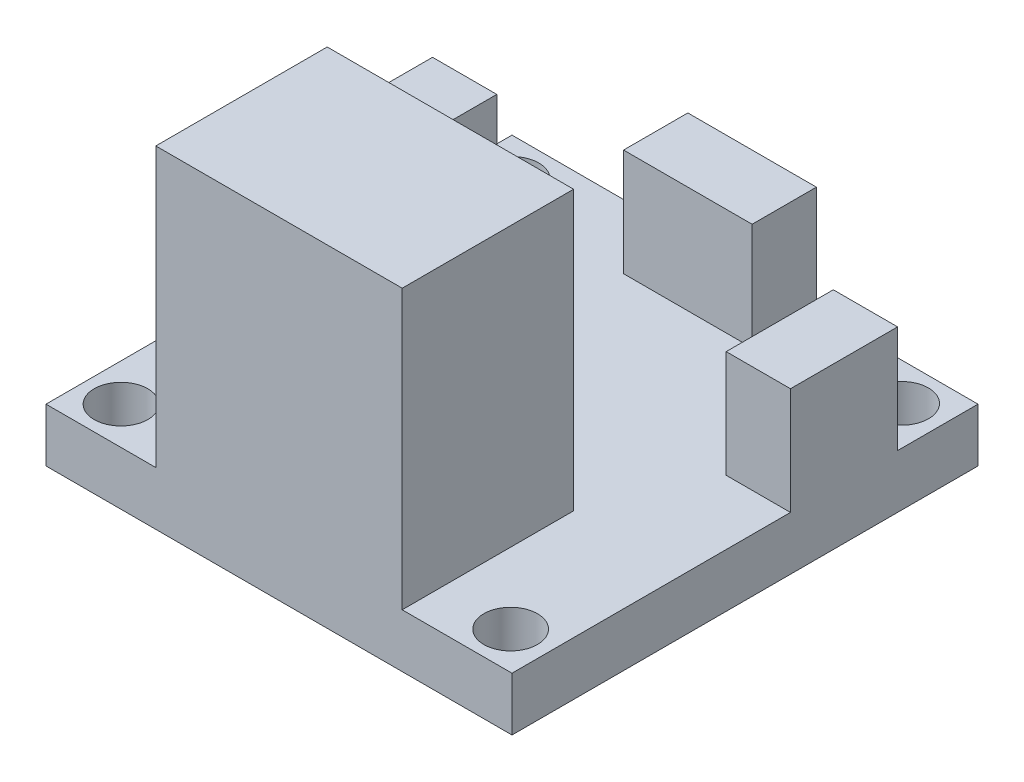
from build123d import *

# Parameters (mm, degrees)
SKETCH2_W           = 43.5
SKETCH2_H           = 43.5
BOSS_EXTRUDE1_DEPTH = 5
SKETCH4_W           = 23
SKETCH4_H           = 16
BOSS_EXTRUDE2_DEPTH = 26
SKETCH5_W           = 6
SKETCH5_H           = 10
SKETCH5_W_2         = 12
SKETCH5_H_2         = 6
BOSS_EXTRUDE3_DEPTH = 10
SKETCH6_R           = 2.5
CUT_EXTRUDE1_DEPTH  = 41.275612969


with BuildPart() as part:
    # Sketch2 → Boss-Extrude1 (new body)
    with BuildSketch(Plane(origin=(0, 0, 0), x_dir=(1, 0, 0), z_dir=(0, 1, 0))):
        Rectangle(SKETCH2_W, SKETCH2_H)
    extrude(amount=BOSS_EXTRUDE1_DEPTH)

    # Sketch4 → Boss-Extrude2 (add)
    with BuildSketch(Plane(origin=(0, 5, 0), x_dir=(1, 0, 0), z_dir=(0, 1, 0))):
        with Locations((0, -13.75)):
            Rectangle(SKETCH4_W, SKETCH4_H)
    extrude(amount=BOSS_EXTRUDE2_DEPTH)

    # Sketch5 → Boss-Extrude3 (add)
    with BuildSketch(Plane(origin=(0, 5, 0), x_dir=(1, 0, 0), z_dir=(0, 1, 0))):
        with Locations((-18.75, 9.331650707)):
            Rectangle(SKETCH5_W, SKETCH5_H)
        with Locations((0.664199044, 18.75)):
            Rectangle(SKETCH5_W_2, SKETCH5_H_2)
        with Locations((18.75, 9.243455857)):
            Rectangle(SKETCH5_W, SKETCH5_H)
    extrude(amount=BOSS_EXTRUDE3_DEPTH)

    # Sketch6 → Cut-Extrude1 (cut, through all)
    with BuildSketch(Plane(origin=(0, 5, 0), x_dir=(1, 0, 0), z_dir=(0, 1, 0))):
        with Locations(Location((-18.25, 18.25, 0), (0, 0, 270))):
            Circle(SKETCH6_R)
        with Locations(Location((18.124031363, 18.25, 0), (0, 0, 270))):
            Circle(SKETCH6_R)
        with Locations(Location((18.124031363, -18.25, 0), (0, 0, 270))):
            Circle(SKETCH6_R)
        with Locations(Location((-18.25, -18.25, 0), (0, 0, 270))):
            Circle(SKETCH6_R)
    extrude(amount=-CUT_EXTRUDE1_DEPTH, mode=Mode.SUBTRACT)


solid = part.part
